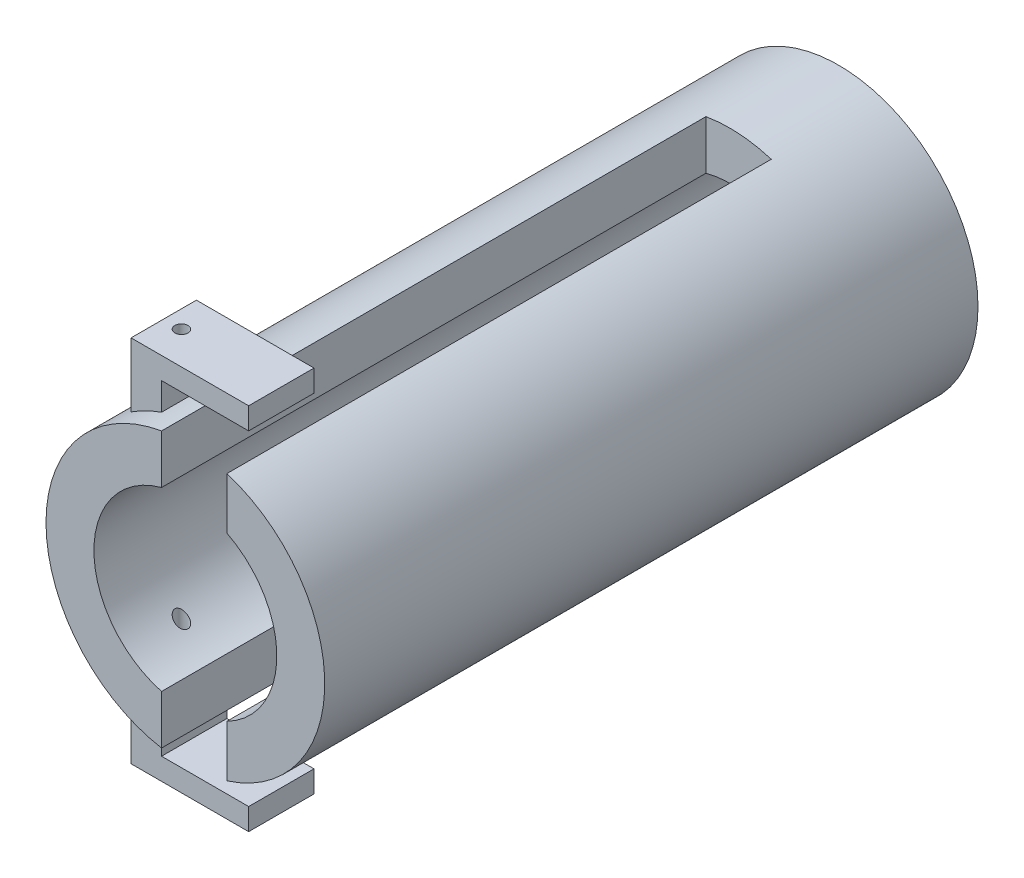
from build123d import *

# Parameters (mm, degrees)
ESBO_O1_R                     = 32
ESBO_O1_R_2                   = 21
RESSALTO_EXTRUS_O1_DEPTH      = 150
CORTE_EXTRUS_O1_DEPTH         = 167.643659607
CORTE_EXTRUS_O1_DEPTH_BACK    = 167.643659607
ESBO_O3_W                     = 125
ESBO_O3_H                     = 15
RESSALTO_EXTRUS_O2_REACH      = 168.644
RESSALTO_EXTRUS_O2_END_RADIUS = 32
ESBO_O4_W                     = 15
ESBO_O4_H                     = 7
ESBO_O5_W                     = 7
ESBO_O5_H                     = 15
RESSALTO_EXTRUS_O3_DEPTH      = 10
ESBO_O6_W                     = 15
ESBO_O6_H                     = 5
RESSALTO_EXTRUS_O4_DEPTH      = 20
RESSALTO_EXTRUS_O5_REACH      = 172.597
RESSALTO_EXTRUS_O5_END_RADIUS = 32
ESBO_O7_W                     = 15
ESBO_O7_H                     = 7
ESBO_O8_W                     = 7
ESBO_O8_H                     = 15
RESSALTO_EXTRUS_O6_DEPTH      = 10
ESBO_O9_W                     = 15
ESBO_O9_H                     = 5
RESSALTO_EXTRUS_O7_DEPTH      = 20
CORTE_EXTRUS_O2_DEPTH         = 176.206236165
CORTE_EXTRUS_O2_DEPTH_BACK    = 176.206236165
ESBO_O10_R                    = 1.5


with BuildPart() as part:
    # Esboço1 → Ressalto-extrusão1 (new body)
    with BuildSketch(Plane.XY):
        Circle(ESBO_O1_R)
        Circle(ESBO_O1_R_2, mode=Mode.SUBTRACT)
    extrude(amount=RESSALTO_EXTRUS_O1_DEPTH)

    # Esboço3 → Corte-extrusão1 (cut, two sides: drawn at the far end of the back side and taken through both)
    with BuildSketch(Plane(origin=(0, -33.162176816, 0), x_dir=(0, 0, -1), z_dir=(0, -1, 0)).offset(-CORTE_EXTRUS_O1_DEPTH_BACK)):
        with Locations((-87.5, 2.034407051)):
            Rectangle(ESBO_O3_W, ESBO_O3_H)
    extrude(amount=CORTE_EXTRUS_O1_DEPTH + CORTE_EXTRUS_O1_DEPTH_BACK, mode=Mode.SUBTRACT)

    # Ressalto-extrusão2: up to this cylinder (the profile starts outside it)
    ressalto_extrus_o2_end = Plane(origin=(0, 0, 137.5), z_dir=(0, 0, -1)) * Cylinder(RESSALTO_EXTRUS_O2_END_RADIUS, 402.288, mode=Mode.PRIVATE)
    # Esboço4 → Ressalto-extrusão2 (add, up to the surface)
    with BuildSketch(Plane(origin=(0, -33.162176816, 0), x_dir=(0, 0, -1), z_dir=(0, -1, 0)), mode=Mode.PRIVATE) as ressalto_extrus_o2_sk1:
        with Locations((-137.5, -13.965592949)):
            Rectangle(ESBO_O4_W, ESBO_O4_H)
    ressalto_extrus_o2_tool1 = extrude(ressalto_extrus_o2_sk1.sketch, amount=-RESSALTO_EXTRUS_O2_REACH, mode=Mode.PRIVATE) - ressalto_extrus_o2_end
    add(ressalto_extrus_o2_tool1.solids().sort_by_distance((-13.965593, -33.162177, 137.5))[0])

    # Esboço5 → Ressalto-extrusão3 (add)
    with BuildSketch(Plane.XZ.offset(33.162176816)):
        with Locations((-13.965592949, 137.5)):
            Rectangle(ESBO_O5_W, ESBO_O5_H)
    extrude(amount=RESSALTO_EXTRUS_O3_DEPTH)

    # Esboço6 → Ressalto-extrusão4 (add)
    with BuildSketch(Plane(origin=(-10.465592949, 0, 0), x_dir=(0, 0, -1), z_dir=(1, 0, 0))):
        with Locations((-137.5, -40.662176816)):
            Rectangle(ESBO_O6_W, ESBO_O6_H)
    extrude(amount=RESSALTO_EXTRUS_O4_DEPTH)

    # Ressalto-extrusão5: up to this cylinder (the profile starts outside it)
    ressalto_extrus_o5_end = Plane(origin=(0, 0, 137.5), z_dir=(0, 0, -1)) * Cylinder(RESSALTO_EXTRUS_O5_END_RADIUS, 410.194, mode=Mode.PRIVATE)
    # Esboço7 → Ressalto-extrusão5 (add, up to the surface)
    with BuildSketch(Plane.ZX.offset(31.532717901), mode=Mode.PRIVATE) as ressalto_extrus_o5_sk1:
        with Locations((137.5, -13.965592949)):
            Rectangle(ESBO_O7_W, ESBO_O7_H)
    ressalto_extrus_o5_tool1 = extrude(ressalto_extrus_o5_sk1.sketch, amount=-RESSALTO_EXTRUS_O5_REACH, mode=Mode.PRIVATE) - ressalto_extrus_o5_end
    add(ressalto_extrus_o5_tool1.solids().sort_by_distance((-13.965593, 31.532718, 137.5))[0])

    # Esboço8 → Ressalto-extrusão6 (add)
    with BuildSketch(Plane(origin=(0, 31.532717901, 0), x_dir=(1, 0, 0), z_dir=(0, 1, 0))):
        with Locations((-13.965592949, -137.5)):
            Rectangle(ESBO_O8_W, ESBO_O8_H)
    extrude(amount=RESSALTO_EXTRUS_O6_DEPTH)

    # Esboço9 → Ressalto-extrusão7 (add)
    with BuildSketch(Plane(origin=(-10.465592949, 0, 0), x_dir=(0, 0, -1), z_dir=(1, 0, 0))):
        with Locations((-137.5, 39.032717901)):
            Rectangle(ESBO_O9_W, ESBO_O9_H)
    extrude(amount=RESSALTO_EXTRUS_O7_DEPTH)

    # Esboço10 → Corte-extrusão2 (cut, two sides: drawn at the far end of the back side and taken through both)
    with BuildSketch(Plane.XZ.offset(43.162176816).offset(-CORTE_EXTRUS_O2_DEPTH_BACK)):
        with Locations((-13.4052452, 137.5)):
            Circle(ESBO_O10_R)
    extrude(amount=CORTE_EXTRUS_O2_DEPTH + CORTE_EXTRUS_O2_DEPTH_BACK, mode=Mode.SUBTRACT)


solid = part.part
